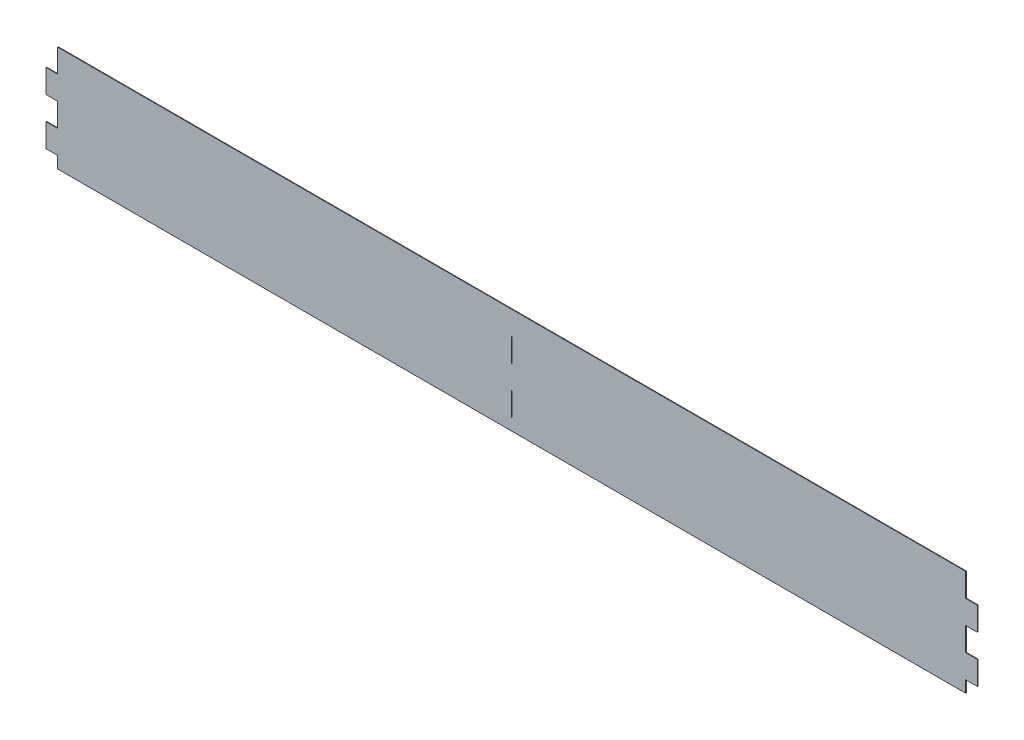
from build123d import *

# Parameters (mm, degrees)
BOSS_EXTRUDE1_DEPTH  = 0.125
SKETCH2_W            = 0.3
SKETCH2_H            = 10
CUT_EXTRUDE1_DEPTH   = 204.537005235
LPATTERN1_COUNT      = 3
LPATTERN1_PITCH      = 20
SKETCH3_W            = 5
SKETCH3_H            = 10
CUT_EXTRUDE2_DEPTH   = 204.537005235
LPATTERN2_COUNT      = 3
LPATTERN2_PITCH      = 20
LPATTERN2_COUNT_DIR2 = 2
LPATTERN2_PITCH_DIR2 = 392


with BuildPart() as part:
    # Sketch1 → Boss-Extrude1 (new, symmetric)
    with BuildSketch(Plane.XY):
        Polygon((198.5, 45), (198.5, 0), (193.5, 0), (0, 0), (-193.5, 0), (-198.5, 0), (-198.5, 45), (-193.5, 45), (193.5, 45), align=None)
    extrude(amount=BOSS_EXTRUDE1_DEPTH, both=True)

    # Sketch2 → Cut-Extrude1 (cut, through all)
    with BuildSketch(Plane.XY.offset(0.125)):
        with Locations((0, 30)):
            Rectangle(SKETCH2_W, SKETCH2_H)
    cut_extrude1 = extrude(amount=-CUT_EXTRUDE1_DEPTH, mode=Mode.SUBTRACT)

    # LPattern1: Cut-Extrude1 ×3
    with Locations(*[(0, -i * LPATTERN1_PITCH, 0) for i in range(1, LPATTERN1_COUNT)]):
        add(cut_extrude1, mode=Mode.SUBTRACT)

    # Sketch3 → Cut-Extrude2 (cut, through all)
    with BuildSketch(Plane.XY.offset(0.125)):
        with Locations((-196, 40)):
            Rectangle(SKETCH3_W, SKETCH3_H)
    cut_extrude2 = extrude(amount=-CUT_EXTRUDE2_DEPTH, mode=Mode.SUBTRACT)

    # LPattern2: Cut-Extrude2 3 × 2
    with Locations(*[(j * LPATTERN2_PITCH_DIR2, -i * LPATTERN2_PITCH, 0) for i in range(LPATTERN2_COUNT) for j in range(LPATTERN2_COUNT_DIR2) if (i, j) != (0, 0)]):
        add(cut_extrude2, mode=Mode.SUBTRACT)


solid = part.part
